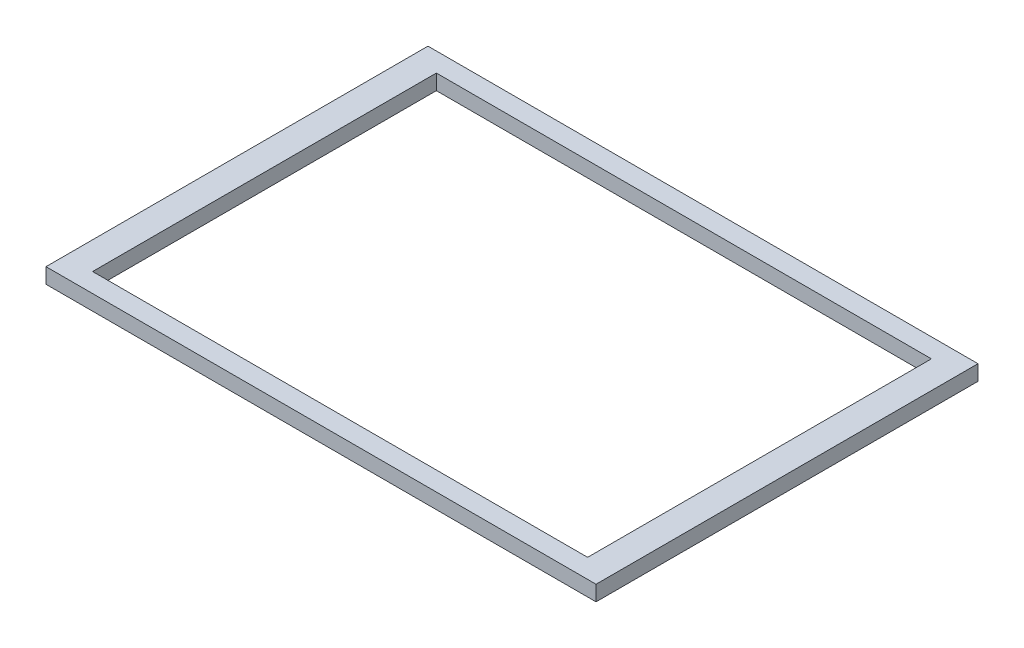
from build123d import *

# Parameters (mm, degrees)
SKETCH2_W           = 36
SKETCH2_H           = 25
SKETCH2_W_2         = 32.4
SKETCH2_H_2         = 22.5
BOSS_EXTRUDE2_DEPTH = 1


with BuildPart() as part:
    # Sketch2 → Boss-Extrude2 (new body)
    with BuildSketch(Plane(origin=(0, 0, 0), x_dir=(1, 0, 0), z_dir=(0, 1, 0))):
        Rectangle(SKETCH2_W, SKETCH2_H)
        Rectangle(SKETCH2_W_2, SKETCH2_H_2, mode=Mode.SUBTRACT)
    extrude(amount=BOSS_EXTRUDE2_DEPTH)


solid = part.part
